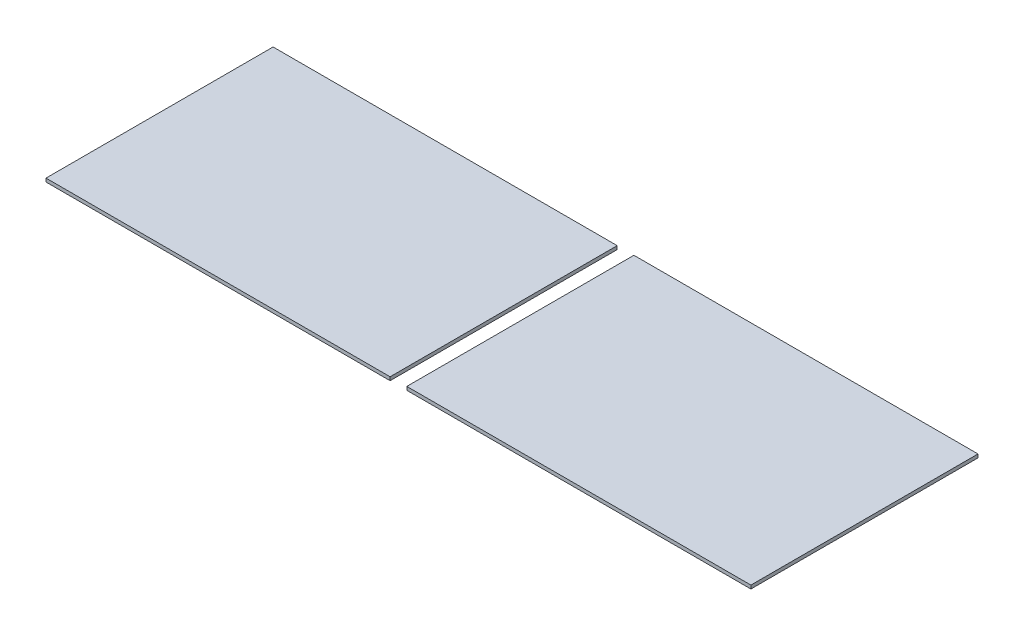
from build123d import *

# Parameters (mm, degrees)
SKETCH1_W           = 500
SKETCH1_H           = 330
BOSS_EXTRUDE1_DEPTH = 5


with BuildPart() as part:
    # Sketch1 → Boss-Extrude1 (new body)
    with BuildSketch(Plane(origin=(0, 0, 0), x_dir=(1, 0, 0), z_dir=(0, 1, 0))):
        with Locations((262.136899299, 0)):
            Rectangle(SKETCH1_W, SKETCH1_H)
    extrude(amount=BOSS_EXTRUDE1_DEPTH)


with BuildPart() as body_2:
    # Mirror3: mirrored copy
    add(part.part.mirror(Plane(origin=(0, 0, 0), x_dir=(0, 0, 1), z_dir=(1, 0, 0))))


solid = Compound([part.part, body_2.part])
